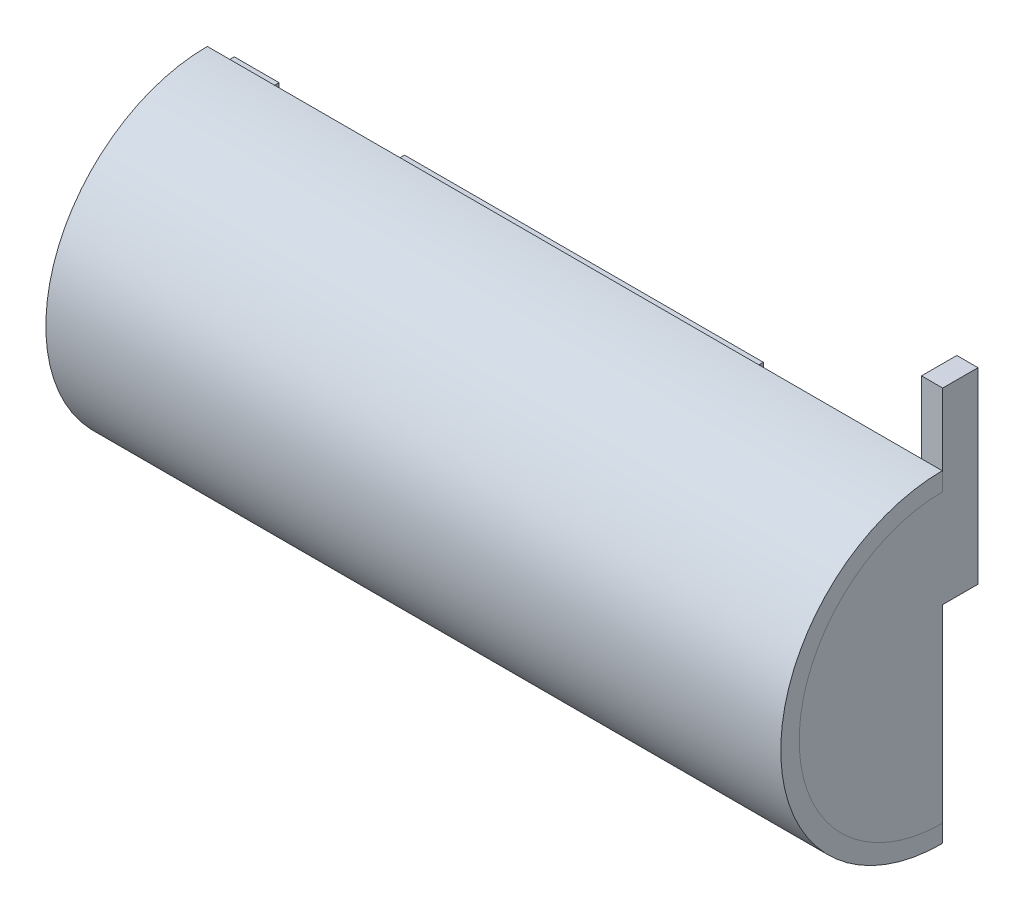
from build123d import *

# Parameters (mm, degrees)
REVOLVE2_ANGLE           = 180
SKETCH5_W                = 2.54
SKETCH5_H                = 12.7
SKETCH5_W_2              = 101.6
SKETCH5_H_2              = 2.54
SKETCH5_W_3              = 12.7
BOSS_EXTRUDE1_DEPTH      = 2.54
SKETCH7_W                = 20
SKETCH7_H                = 50
CUT_EXTRUDE1_DEPTH       = 7
BOSS_EXTRUDE3_REACH      = 220.035
SKETCH8_W                = 5
SKETCH8_H                = 91.44
SKETCH9_W                = 6.129296028
SKETCH9_H                = 8.078685473
BOSS_EXTRUDE4_DEPTH      = 2
BOSS_EXTRUDE7_START      = 8
BOSS_EXTRUDE7_DEPTH      = 8
BOSS_EXTRUDE8_REACH      = 220.035
BOSS_EXTRUDE8_END_RADIUS = 40.64
SKETCH13_W               = 75.08
SKETCH13_H               = 60.08
SKETCH13_W_2             = 70
SKETCH13_H_2             = 55
SKETCH14_W               = 75.08
SKETCH14_H               = 60.08
CUT_EXTRUDE3_DEPTH       = 11
BOSS_EXTRUDE9_REACH      = 217.997
SKETCH15_W               = 70
SKETCH15_H               = 55
CUT_EXTRUDE5_DEPTH       = 15
CUT_EXTRUDE6_REACH       = 202.84
SKETCH18_W               = 12
SKETCH18_H               = 56
BOSS_EXTRUDE10_REACH     = 220.035
SKETCH23_W               = 6
SKETCH23_H               = 81.28
SKETCH26_W               = 6
SKETCH26_H               = 53.107211962
BOSS_EXTRUDE11_DEPTH     = 10


with BuildPart() as part:
    # Sketch2 → Revolve2 (revolve)
    with BuildSketch(Plane.XY):
        Polygon((0, 0), (0, 40.64), (0, 45.72), (25.4, 45.72), (195.4, 45.72), (208.1, 45.72), (208.22771659, 40.64), (195.52771659, 40.64), (25.4, 40.64), (5.08, 40.64), (5.08, 0), align=None)
    revolve(axis=Axis((0, 0, 0), (1, 0, 0)), revolution_arc=REVOLVE2_ANGLE)

    # Sketch5 → Boss-Extrude1 (add)
    with BuildSketch(Plane(origin=(0, 0, 0), x_dir=(-1, 0, 0), z_dir=(0, 0, -1))):
        with Locations((-2.54, 34.29)):
            Rectangle(SKETCH5_W, SKETCH5_H)
        with Locations((-104.113858295, -43.18)):
            Rectangle(SKETCH5_W_2, SKETCH5_H_2)
        with Locations((-11.43, 43.18)):
            Rectangle(SKETCH5_W_3, SKETCH5_H_2)
        with Locations((-104.113858295, 43.18)):
            Rectangle(SKETCH5_W_2, SKETCH5_H_2)
        with Locations((-11.43, -43.18)):
            Rectangle(SKETCH5_W_3, SKETCH5_H_2)
        with Locations((-2.54, -34.29)):
            Rectangle(SKETCH5_W, SKETCH5_H)
    extrude(amount=BOSS_EXTRUDE1_DEPTH)

    # Sketch7 → Cut-Extrude1 (cut)
    with BuildSketch(Plane.ZY):
        with Locations((10, 0)):
            Rectangle(SKETCH7_W, SKETCH7_H)
    extrude(amount=-CUT_EXTRUDE1_DEPTH, mode=Mode.SUBTRACT)

    # Sketch8 → Boss-Extrude3 (add, up to next)
    with BuildSketch(Plane(origin=(0, 0, 0), x_dir=(-1, 0, 0), z_dir=(0, 0, -1)), mode=Mode.PRIVATE) as boss_extrude3_sk1:
        with Locations((-15.58, 0)):
            Rectangle(SKETCH8_W, SKETCH8_H)
    boss_extrude3_tool1 = extrude(boss_extrude3_sk1.sketch, amount=-BOSS_EXTRUDE3_REACH, mode=Mode.PRIVATE) - part.part
    add(boss_extrude3_tool1.solids().sort_by_distance((15.58, 0, 0))[0])

    # Sketch9 → Boss-Extrude4 (add)
    with BuildSketch(Plane(origin=(5.08, 0, 0), x_dir=(0, 0, -1), z_dir=(1, 0, 0))):
        with Locations((-3.906446672, 33.952493663)):
            Rectangle(SKETCH9_W, SKETCH9_H)
    extrude(amount=BOSS_EXTRUDE4_DEPTH)

    # Sketch12 → Boss-Extrude7 (add)
    with BuildSketch(Plane.ZY.offset(-13.08).offset(BOSS_EXTRUDE7_START)):
        with BuildLine():
            Line((23.64, 33.056920607), (23.64, -33.056920607))
            ThreePointArc((23.64, -33.056920607), (40.64, 0), (23.64, 33.056920607))
        make_face()
    extrude(amount=-BOSS_EXTRUDE7_DEPTH)

    # Boss-Extrude8: up to this cylinder (the profile starts inside it)
    boss_extrude8_end = Plane(origin=(148.153858, 0, 0), z_dir=(-1, 0, 0)) * Cylinder(BOSS_EXTRUDE8_END_RADIUS, 522.35, mode=Mode.PRIVATE)
    # Sketch13 → Boss-Extrude8 (add, up to the surface)
    with BuildSketch(Plane(origin=(0, 0, 0), x_dir=(-1, 0, 0), z_dir=(0, 0, -1)), mode=Mode.PRIVATE) as boss_extrude8_sk1:
        with Locations((-148.153858295, 0)):
            Rectangle(SKETCH13_W, SKETCH13_H)
        with Locations((-148.153858295, 0)):
            Rectangle(SKETCH13_W_2, SKETCH13_H_2, mode=Mode.SUBTRACT)
    boss_extrude8_tool1 = extrude(boss_extrude8_sk1.sketch, amount=-BOSS_EXTRUDE8_REACH, mode=Mode.PRIVATE) & boss_extrude8_end
    add(boss_extrude8_tool1.solids().sort_by_distance((148.153858, 29.078407, 0))[0])

    # Sketch14 → Cut-Extrude3 (cut)
    with BuildSketch(Plane(origin=(0, 0, 0), x_dir=(-1, 0, 0), z_dir=(0, 0, -1))):
        with Locations((-148.153858295, 0)):
            Rectangle(SKETCH14_W, SKETCH14_H)
    extrude(amount=-CUT_EXTRUDE3_DEPTH, mode=Mode.SUBTRACT)

    # Sketch15 → Boss-Extrude9 (add, up to next)
    with BuildSketch(Plane(origin=(0, 0, 11), x_dir=(-1, 0, 0), z_dir=(0, 0, -1)), mode=Mode.PRIVATE) as boss_extrude9_sk1:
        with Locations((-148.153858295, 0)):
            Rectangle(SKETCH15_W, SKETCH15_H)
    boss_extrude9_tool1 = extrude(boss_extrude9_sk1.sketch, amount=-BOSS_EXTRUDE9_REACH, mode=Mode.PRIVATE) - part.part
    add(boss_extrude9_tool1.solids().sort_by_distance((148.153858, 0, 11))[0])

    # Sketch17 → Cut-Extrude5 (cut)
    with BuildSketch(Plane(origin=(0, 0, 11), x_dir=(-1, 0, 0), z_dir=(0, 0, -1))):
        Polygon((-113.153858295, 27.5), (-183.153858295, 27.5), (-183.153858295, 19.5), (-185.693858295, 19.5), (-185.693858295, 5.5), (-183.153858295, 5.5), (-183.153858295, -13.5), (-185.693858295, -13.5), (-185.693858295, -24.5), (-183.153858295, -24.5), (-183.153858295, -27.5), (-113.153858295, -27.5), align=None)
    extrude(amount=-CUT_EXTRUDE5_DEPTH, mode=Mode.SUBTRACT)

    # Sketch18 → Cut-Extrude6 (cut, up to next)
    with BuildSketch(Plane(origin=(18.08, 0, 0), x_dir=(0, 0, -1), z_dir=(1, 0, 0)), mode=Mode.PRIVATE) as cut_extrude6_sk1:
        with Locations((-6, -10.004795356)):
            Rectangle(SKETCH18_W, SKETCH18_H)
    cut_extrude6_tool1 = extrude(cut_extrude6_sk1.sketch, amount=-CUT_EXTRUDE6_REACH, mode=Mode.PRIVATE) & part.part
    add(cut_extrude6_tool1.solids().sort_by_distance((18.08, -10.004795, 6))[0], mode=Mode.SUBTRACT)

    # Sketch23 → Boss-Extrude10 (add, up to next)
    with BuildSketch(Plane(origin=(0, 0, 0), x_dir=(-1, 0, 0), z_dir=(0, 0, -1)), mode=Mode.PRIVATE) as boss_extrude10_sk1:
        with Locations((-205.22771659, 0)):
            Rectangle(SKETCH23_W, SKETCH23_H)
    boss_extrude10_tool1 = extrude(boss_extrude10_sk1.sketch, amount=-BOSS_EXTRUDE10_REACH, mode=Mode.PRIVATE) - part.part
    add(boss_extrude10_tool1.solids().sort_by_distance((205.227717, 0, 0))[0])

    # Sketch26 → Boss-Extrude11 (add)
    with BuildSketch(Plane(origin=(0, 0, 0), x_dir=(-1, 0, 0), z_dir=(0, 0, -1))):
        with Locations((-205.22771659, 39.5)):
            Rectangle(SKETCH26_W, SKETCH26_H)
    extrude(amount=BOSS_EXTRUDE11_DEPTH)


solid = part.part
